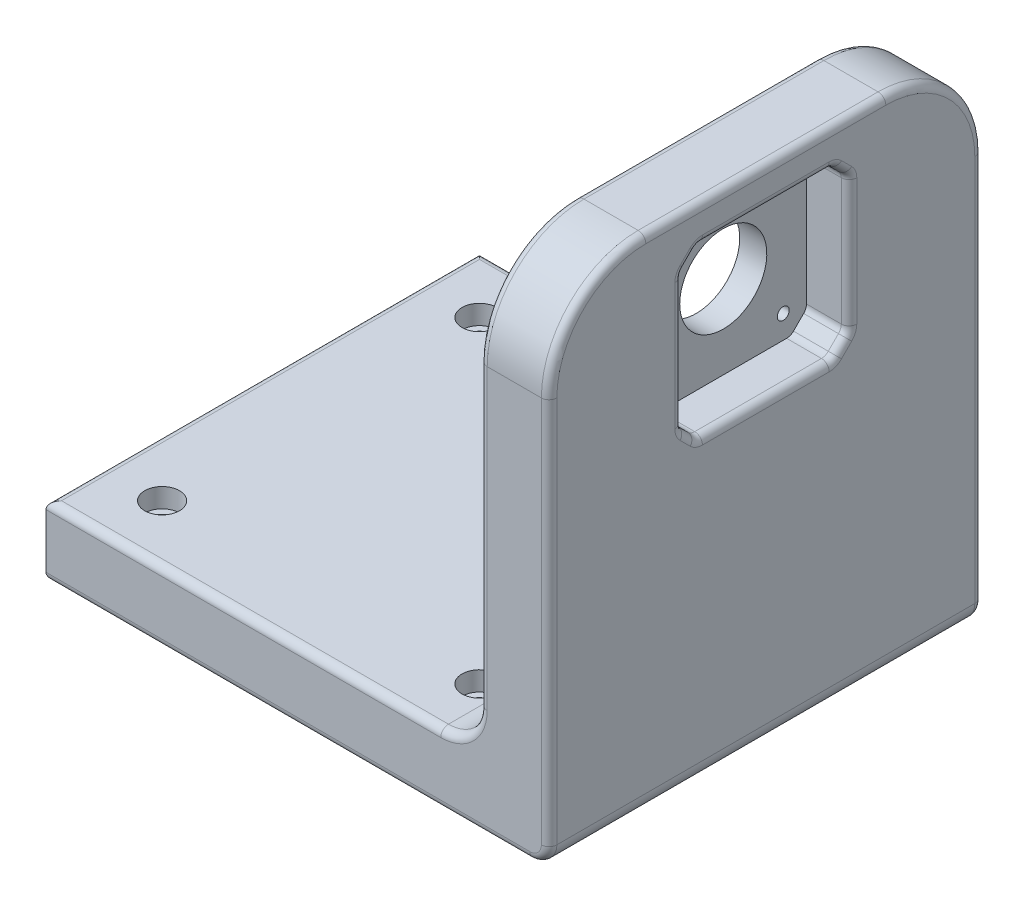
from build123d import *

# Parameters (mm, degrees)
BOSS_EXTRUDE1_DEPTH     = 56
CUT_EXTRUDE1_DEPTH      = 11
SKETCH6_R               = 11.25
SKETCH6_R_2             = 11
CUT_EXTRUDE3_DEPTH      = 7
CUT_EXTRUDE4_REACH      = 182.499
SKETCH7_R               = 1.55
SKETCH8_R               = 2.75
SKETCH8_R_2             = 1.55
CUT_EXTRUDE5_DEPTH      = 3
SKETCH9_R               = 4.5
SKETCH9_R_2             = 2.75
CUT_EXTRUDE6_DEPTH      = 5
CUT_EXTRUDE7_DEPTH      = 181.499307478
CUT_EXTRUDE7_DEPTH_BACK = 181.499307478
SKETCH9_3_R             = 2.75
FILLET1_R               = 10
FILLET2_R               = 25
FILLET3_R               = 5
FILLET4_R               = 2


with BuildPart() as part:
    # Sketch1 → Boss-Extrude1 (new, symmetric)
    with BuildSketch(Plane.XY):
        Polygon((130, 0), (130, 130), (112, 130), (112, 18), (0, 18), (0, 0), align=None)
    extrude(amount=BOSS_EXTRUDE1_DEPTH, both=True)

    # Sketch2 → Cut-Extrude1 (cut)
    with BuildSketch(Plane(origin=(130, 0, 0), x_dir=(0, 0, -1), z_dir=(1, 0, 0))):
        with BuildLine():
            Line((-20.060660172, 81.717766953), (-17.432233047, 79.089339828))
            ThreePointArc((-17.432233047, 79.089339828), (-16.945598024, 78.764180701), (-16.371572875, 78.65))
            Line((-16.371572875, 78.65), (16.371572875, 78.65))
            ThreePointArc((16.371572875, 78.65), (16.945598024, 78.764180701), (17.432233047, 79.089339828))
            Line((17.432233047, 79.089339828), (20.060660172, 81.717766953))
            ThreePointArc((20.060660172, 81.717766953), (20.385819299, 82.204401976), (20.5, 82.778427125))
            Line((20.5, 82.778427125), (20.5, 115.521572875))
            ThreePointArc((20.5, 115.521572875), (20.385819299, 116.095598024), (20.060660172, 116.582233047))
            Line((20.060660172, 116.582233047), (17.432233047, 119.210660172))
            ThreePointArc((17.432233047, 119.210660172), (16.945598024, 119.535819299), (16.371572875, 119.65))
            Line((16.371572875, 119.65), (-16.371572875, 119.65))
            ThreePointArc((-16.371572875, 119.65), (-16.945598024, 119.535819299), (-17.432233047, 119.210660172))
            Line((-17.432233047, 119.210660172), (-20.060660172, 116.582233047))
            ThreePointArc((-20.060660172, 116.582233047), (-20.385819299, 116.095598024), (-20.5, 115.521572875))
            Line((-20.5, 115.521572875), (-20.5, 82.778427125))
            ThreePointArc((-20.5, 82.778427125), (-20.385819299, 82.204401976), (-20.060660172, 81.717766953))
        make_face()
        with BuildLine():
            Line((-20.767766953, 81.010660172), (-18.139339828, 78.382233047))
            ThreePointArc((-18.139339828, 78.382233047), (-17.328281456, 77.840301169), (-16.371572875, 77.65))
            Line((-16.371572875, 77.65), (16.371572875, 77.65))
            ThreePointArc((16.371572875, 77.65), (17.328281456, 77.840301169), (18.139339828, 78.382233047))
            Line((18.139339828, 78.382233047), (20.767766953, 81.010660172))
            ThreePointArc((20.767766953, 81.010660172), (21.309698831, 81.821718544), (21.5, 82.778427125))
            Line((21.5, 82.778427125), (21.5, 115.521572875))
            ThreePointArc((21.5, 115.521572875), (21.309698831, 116.478281456), (20.767766953, 117.289339828))
            Line((20.767766953, 117.289339828), (18.139339828, 119.917766953))
            ThreePointArc((18.139339828, 119.917766953), (17.328281456, 120.459698831), (16.371572875, 120.65))
            Line((16.371572875, 120.65), (-16.371572875, 120.65))
            ThreePointArc((-16.371572875, 120.65), (-17.328281456, 120.459698831), (-18.139339828, 119.917766953))
            Line((-18.139339828, 119.917766953), (-20.767766953, 117.289339828))
            ThreePointArc((-20.767766953, 117.289339828), (-21.309698831, 116.478281456), (-21.5, 115.521572875))
            Line((-21.5, 115.521572875), (-21.5, 82.778427125))
            ThreePointArc((-21.5, 82.778427125), (-21.309698831, 81.821718544), (-20.767766953, 81.010660172))
        make_face()
    extrude(amount=-CUT_EXTRUDE1_DEPTH, mode=Mode.SUBTRACT)

    # Sketch6 → Cut-Extrude3 (cut)
    with BuildSketch(Plane.ZY.offset(-119)):
        with Locations(Location((0, 99.15, 0), (0, 0, 90))):
            Circle(SKETCH6_R)
        with Locations((0, 99.15)):
            Circle(SKETCH6_R_2, mode=Mode.SUBTRACT)
    extrude(amount=CUT_EXTRUDE3_DEPTH, mode=Mode.SUBTRACT)


with BuildPart() as cut_extrude3_kept_piece:
    # of the separate pieces the step leaves, the one the design keeps (cut_extrude3_pieces_kept)
    add(part.part.solids().sort_by_distance((130, 0, -56))[0])

    # Sketch7 → Cut-Extrude4 (cut, up to next)
    with BuildSketch(Plane.ZY.offset(-112), mode=Mode.PRIVATE) as cut_extrude4_sk1:
        with Locations(Location((-15.5, 83.65, 0), (0, 0, 270))):
            Circle(SKETCH7_R)
    cut_extrude4_tool1 = extrude(cut_extrude4_sk1.sketch, amount=-CUT_EXTRUDE4_REACH, mode=Mode.PRIVATE) & cut_extrude3_kept_piece.part
    # Sketch7 → Cut-Extrude4 (cut, up to next)
    with BuildSketch(Plane.ZY.offset(-112), mode=Mode.PRIVATE) as cut_extrude4_sk2:
        with Locations(Location((15.5, 83.65, 0), (0, 0, 270))):
            Circle(SKETCH7_R)
    cut_extrude4_tool2 = extrude(cut_extrude4_sk2.sketch, amount=-CUT_EXTRUDE4_REACH, mode=Mode.PRIVATE) & cut_extrude3_kept_piece.part
    # Sketch7 → Cut-Extrude4 (cut, up to next)
    with BuildSketch(Plane.ZY.offset(-112), mode=Mode.PRIVATE) as cut_extrude4_sk3:
        with Locations(Location((15.5, 114.65, 0), (0, 0, 270))):
            Circle(SKETCH7_R)
    cut_extrude4_tool3 = extrude(cut_extrude4_sk3.sketch, amount=-CUT_EXTRUDE4_REACH, mode=Mode.PRIVATE) & cut_extrude3_kept_piece.part
    # Sketch7 → Cut-Extrude4 (cut, up to next)
    with BuildSketch(Plane.ZY.offset(-112), mode=Mode.PRIVATE) as cut_extrude4_sk4:
        with Locations(Location((-15.5, 114.65, 0), (0, 0, 270))):
            Circle(SKETCH7_R)
    cut_extrude4_tool4 = extrude(cut_extrude4_sk4.sketch, amount=-CUT_EXTRUDE4_REACH, mode=Mode.PRIVATE) & cut_extrude3_kept_piece.part
    add(cut_extrude4_tool1.solids().sort_by_distance((112, 83.65, -15.5))[0], mode=Mode.SUBTRACT)
    add(cut_extrude4_tool2.solids().sort_by_distance((112, 83.65, 15.5))[0], mode=Mode.SUBTRACT)
    add(cut_extrude4_tool3.solids().sort_by_distance((112, 114.65, 15.5))[0], mode=Mode.SUBTRACT)
    add(cut_extrude4_tool4.solids().sort_by_distance((112, 114.65, -15.5))[0], mode=Mode.SUBTRACT)

    # Sketch8 → Cut-Extrude5 (cut)
    # profile 1 of 4: a face of its own
    with BuildSketch(Plane.ZY.offset(-112)):
        with Locations(Location((-15.5, 114.65, 0), (0, 0, 270))):
            Circle(SKETCH8_R)
        with Locations(Location((-15.5, 114.65, 0), (0, 0, 270))):
            Circle(SKETCH8_R_2, mode=Mode.SUBTRACT)
    # profile 2 of 4: a face of its own
    with BuildSketch(Plane.ZY.offset(-112)):
        with Locations(Location((15.5, 114.65, 0), (0, 0, 270))):
            Circle(SKETCH8_R)
        with Locations(Location((15.5, 114.65, 0), (0, 0, 270))):
            Circle(SKETCH8_R_2, mode=Mode.SUBTRACT)
    # profile 3 of 4: a face of its own
    with BuildSketch(Plane.ZY.offset(-112)):
        with Locations(Location((15.5, 83.65, 0), (0, 0, 270))):
            Circle(SKETCH8_R)
        with Locations(Location((15.5, 83.65, 0), (0, 0, 270))):
            Circle(SKETCH8_R_2, mode=Mode.SUBTRACT)
    # profile 4 of 4: a face of its own
    with BuildSketch(Plane.ZY.offset(-112)):
        with Locations(Location((-15.5, 83.65, 0), (0, 0, 270))):
            Circle(SKETCH8_R)
        with Locations(Location((-15.5, 83.65, 0), (0, 0, 270))):
            Circle(SKETCH8_R_2, mode=Mode.SUBTRACT)
    extrude(amount=-CUT_EXTRUDE5_DEPTH, mode=Mode.SUBTRACT)

    # Sketch9 → Cut-Extrude6 (cut)
    # profile 1 of 8: a face of its own
    with BuildSketch(Plane(origin=(0, 18, 0), x_dir=(1, 0, 0), z_dir=(0, 1, 0))):
        with Locations(Location((15, -41, 0), (0, 0, 180))):
            Circle(SKETCH9_R)
        with Locations((15, -41)):
            Circle(SKETCH9_R_2, mode=Mode.SUBTRACT)
    # profile 2 of 8: a face of its own
    with BuildSketch(Plane(origin=(0, 18, 0), x_dir=(1, 0, 0), z_dir=(0, 1, 0))):
        with Locations((15, -41)):
            Circle(SKETCH9_R_2)
    # profile 3 of 8: a face of its own
    with BuildSketch(Plane(origin=(0, 18, 0), x_dir=(1, 0, 0), z_dir=(0, 1, 0))):
        with Locations(Location((15, 41, 0), (0, 0, 180))):
            Circle(SKETCH9_R)
        with Locations((15, 41)):
            Circle(SKETCH9_R_2, mode=Mode.SUBTRACT)
    # profile 4 of 8: a face of its own
    with BuildSketch(Plane(origin=(0, 18, 0), x_dir=(1, 0, 0), z_dir=(0, 1, 0))):
        with Locations((15, 41)):
            Circle(SKETCH9_R_2)
    # profile 5 of 8: a face of its own
    with BuildSketch(Plane(origin=(0, 18, 0), x_dir=(1, 0, 0), z_dir=(0, 1, 0))):
        with Locations(Location((97, 41, 0), (0, 0, 180))):
            Circle(SKETCH9_R)
        with Locations((97, 41)):
            Circle(SKETCH9_R_2, mode=Mode.SUBTRACT)
    # profile 6 of 8: a face of its own
    with BuildSketch(Plane(origin=(0, 18, 0), x_dir=(1, 0, 0), z_dir=(0, 1, 0))):
        with Locations((97, 41)):
            Circle(SKETCH9_R_2)
    # profile 7 of 8: a face of its own
    with BuildSketch(Plane(origin=(0, 18, 0), x_dir=(1, 0, 0), z_dir=(0, 1, 0))):
        with Locations(Location((97, -41, 0), (0, 0, 180))):
            Circle(SKETCH9_R)
        with Locations((97, -41)):
            Circle(SKETCH9_R_2, mode=Mode.SUBTRACT)
    # profile 8 of 8: a face of its own
    with BuildSketch(Plane(origin=(0, 18, 0), x_dir=(1, 0, 0), z_dir=(0, 1, 0))):
        with Locations((97, -41)):
            Circle(SKETCH9_R_2)
    extrude(amount=-CUT_EXTRUDE6_DEPTH, mode=Mode.SUBTRACT)

    # Sketch9<3> → Cut-Extrude7 (cut, two sides: drawn at the far end of the back side and taken through both)
    with BuildSketch(Plane(origin=(0, 18, 0), x_dir=(1, 0, 0), z_dir=(0, 1, 0)).offset(-CUT_EXTRUDE7_DEPTH_BACK)):
        with Locations(Location((15, 41, 0), (0, 0, 180))):
            Circle(SKETCH9_3_R)
        with Locations(Location((97, 41, 0), (0, 0, 180))):
            Circle(SKETCH9_3_R)
        with Locations(Location((97, -41, 0), (0, 0, 180))):
            Circle(SKETCH9_3_R)
        with Locations(Location((15, -41, 0), (0, 0, 180))):
            Circle(SKETCH9_3_R)
    extrude(amount=CUT_EXTRUDE7_DEPTH + CUT_EXTRUDE7_DEPTH_BACK, mode=Mode.SUBTRACT)

    # Fillet1
    fillet1_edges = [cut_extrude3_kept_piece.edges().sort_by_distance(p)[0] for p in [
        (112, 18, 0),
    ]]
    fillet(fillet1_edges, radius=FILLET1_R)

    # Fillet2
    fillet2_edges = [cut_extrude3_kept_piece.edges().sort_by_distance(p)[0] for p in [
        (121, 130, -56),
        (121, 130, 56),
    ]]
    fillet(fillet2_edges, radius=FILLET2_R)

    # Fillet3
    fillet3_edges = [cut_extrude3_kept_piece.edges().sort_by_distance(p)[0] for p in [
        (130, 0, 0),
    ]]
    fillet(fillet3_edges, radius=FILLET3_R)

    # Fillet4
    fillet4_edges = [cut_extrude3_kept_piece.edges().sort_by_distance(p)[0] for p in [
        (51, 18, -56),
        (51, 18, 56),
        (109.071067812, 20.928932188, -56),
        (109.071067812, 20.928932188, 56),
        (112, 130, 0),
        (130, 130, 0),
        (112, 66.5, -56),
        (112, 66.5, 56),
        (112, 122.67766953, 48.67766953),
        (112, 122.67766953, -48.67766953),
        (130, 122.67766953, 48.67766953),
        (130, 122.67766953, -48.67766953),
        (130, 55, -56),
        (130, 55, 56),
        (128.535533906, 1.464466094, -56),
        (128.535533906, 1.464466094, 56),
        (0, 18, 0),
        (62.5, 0, -56),
        (0, 0, 0),
        (62.5, 0, 56),
        (130, 79.696446609, 19.453553391),
        (130, 81.821718544, 21.309698831),
        (130, 99.15, 21.5),
        (130, 116.478281456, 21.309698831),
        (130, 118.603553391, 19.453553391),
        (130, 120.459698831, 17.328281456),
        (130, 120.65, 0),
        (130, 120.459698831, -17.328281456),
        (130, 118.603553391, -19.453553391),
        (130, 116.478281456, -21.309698831),
        (130, 99.15, -21.5),
        (130, 81.821718544, -21.309698831),
        (130, 79.696446609, -19.453553391),
        (130, 77.840301169, -17.328281456),
        (130, 77.65, 0),
        (130, 77.840301169, 17.328281456),
    ]]
    fillet(fillet4_edges, radius=FILLET4_R)


solid = cut_extrude3_kept_piece.part
